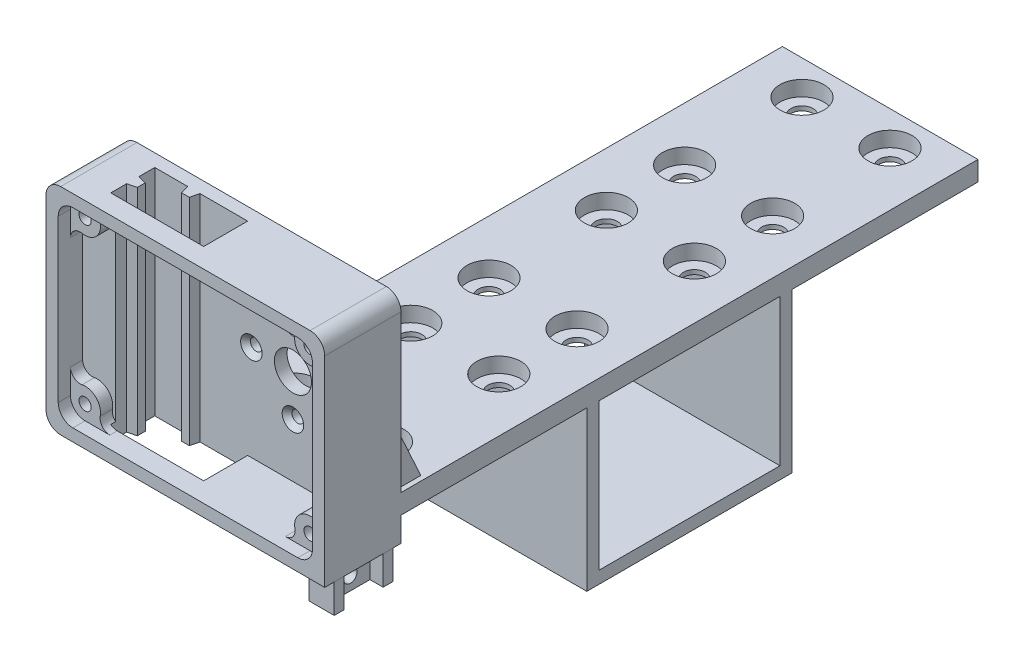
from build123d import *

# Parameters (mm, degrees)
SKETCH1_W                                           = 37
SKETCH1_H                                           = 30
BOSS_EXTRUDE1_DEPTH                                 = 40
CBORE_FOR_M4_PAN_HEAD_MACHINE_SCREW1_D              = 4.5
CBORE_FOR_M4_PAN_HEAD_MACHINE_SCREW1_DEPTH          = 4
CBORE_FOR_M4_PAN_HEAD_MACHINE_SCREW1_CBORE_D        = 9
CBORE_FOR_M4_PAN_HEAD_MACHINE_SCREW1_CBORE_DEPTH    = 3.1
SKETCH5_W                                           = 8
SKETCH5_H                                           = 5.35
SKETCH5_R                                           = 1.35
BOSS_EXTRUDE2_DEPTH                                 = 3
SKETCH6_W                                           = 8
SKETCH6_H                                           = 5.35
SKETCH6_R                                           = 1.35
BOSS_EXTRUDE3_DEPTH                                 = 6
BOSS_EXTRUDE4_REACH                                 = 130.294
SKETCH7_W                                           = 0.8
SKETCH7_H                                           = 2.4
BOSS_EXTRUDE6_DEPTH                                 = 35
BOSS_EXTRUDE6_DEPTH_BACK                            = 9
SKETCH9_W                                           = 57
SKETCH9_H                                           = 2.6
SKETCH8_W                                           = 0.8
SKETCH8_H                                           = 2.4
BOSS_EXTRUDE5_DEPTH                                 = 2
RIB2_REACH                                          = 132.554
SKETCH11_WALL_W                                     = 275.108578948
SKETCH11_WALL_H                                     = 2
RIB3_REACH                                          = 138.749
SKETCH12_WALL_W                                     = 287.498976232
SKETCH12_WALL_H                                     = 2
CUT_EXTRUDE1_REACH                                  = 139.566
SKETCH13_R                                          = 3.8
SKETCH14_W                                          = 57
SKETCH14_H                                          = 44
BOSS_EXTRUDE7_DEPTH                                 = 13
CUT_EXTRUDE2_DEPTH                                  = 13
FILLET3_R                                           = 3
BOSS_EXTRUDE8_DEPTH                                 = 8
CUT_EXTRUDE3_REACH                                  = 153.917
CSK_FOR_M2_COUNTERSUNK_FLAT_HEAD_SCREW1_D           = 2.4
CSK_FOR_M2_COUNTERSUNK_FLAT_HEAD_SCREW1_CSINK_D     = 4.4
CSK_FOR_M2_COUNTERSUNK_FLAT_HEAD_SCREW1_CSINK_ANGLE = 90
BOSS_EXTRUDE9_DEPTH                                 = 10.5
FILLET4_R                                           = 2
MIRROR2_COPY_1_DEPTH                                = 10.5
FILLET5_R                                           = 2
M3_TAPPED_HOLE1_D                                   = 2.5
M3_TAPPED_HOLE1_DEPTH                               = 10
M3_TAPPED_HOLE1_TIP                                 = 0.751075774
BOSS_EXTRUDE10_DEPTH                                = 6
CUT_EXTRUDE5_REACH                                  = 137.472
SKETCH30_R                                          = 1.35
SKETCH31_R                                          = 1.3
CUT_EXTRUDE6_DEPTH                                  = 7
FILLET6_R                                           = 2
SKETCH37_R                                          = 0.9
BOSS_EXTRUDE12_DEPTH                                = 6
BOSS_EXTRUDE12_DRAFT                                = 1
BOSS_EXTRUDE12_PROFILE_2_DEPTH                      = 6
BOSS_EXTRUDE12_PROFILE_2_DRAFT                      = 1


with BuildPart() as part:
    # Sketch1 → Boss-Extrude1 (new body)
    with BuildSketch(Plane(origin=(0, 0, 0), x_dir=(0, 0, -1), z_dir=(1, 0, 0))):
        Polygon((0, 0), (118, 0), (118, -4), (80, -4), (80, -36.5), (38, -36.5), (38, -4), (0, -4), align=None)
        with Locations((59, -19)):
            Rectangle(SKETCH1_W, SKETCH1_H, mode=Mode.SUBTRACT)
    extrude(amount=-BOSS_EXTRUDE1_DEPTH)

    # CBORE for M4 Pan Head Machine Screw1
    with Locations(Plane(origin=(-11, 0, -111), x_dir=(0, 0, 1), z_dir=(0, 1, 0))):
        with Locations((0, 0), (0, -18), (24, 0), (24, -18), (40, 0), (64, 0), (64, -18), (40, -18), (80, 0), (80, -18), (104, -18), (104, 0)):
            CounterBoreHole(CBORE_FOR_M4_PAN_HEAD_MACHINE_SCREW1_D / 2, CBORE_FOR_M4_PAN_HEAD_MACHINE_SCREW1_CBORE_D / 2, CBORE_FOR_M4_PAN_HEAD_MACHINE_SCREW1_CBORE_DEPTH, depth=CBORE_FOR_M4_PAN_HEAD_MACHINE_SCREW1_DEPTH)

    # Sketch5 → Boss-Extrude2 (add)
    with BuildSketch(Plane(origin=(-39, 0, 0), x_dir=(0, 0, -1), z_dir=(1, 0, 0))):
        with Locations((59, -39.175)):
            Rectangle(SKETCH5_W, SKETCH5_H)
        with Locations((59, -39.5)):
            Circle(SKETCH5_R, mode=Mode.SUBTRACT)
    extrude(amount=BOSS_EXTRUDE2_DEPTH)

    # Sketch6 → Boss-Extrude3 (add)
    with BuildSketch(Plane(origin=(-28, 0, 0), x_dir=(0, 0, -1), z_dir=(1, 0, 0))):
        with Locations((59, -39.175)):
            Rectangle(SKETCH6_W, SKETCH6_H)
        with Locations((59, -39.5)):
            Circle(SKETCH6_R, mode=Mode.SUBTRACT)
    extrude(amount=BOSS_EXTRUDE3_DEPTH)

    # Sketch7 → Boss-Extrude4 (add, up to next)
    with BuildSketch(Plane.ZY.offset(28), mode=Mode.PRIVATE) as boss_extrude4_sk1:
        with Locations((-62.6, -39.7)):
            Rectangle(SKETCH7_W, SKETCH7_H)
    boss_extrude4_tool1 = extrude(boss_extrude4_sk1.sketch, amount=BOSS_EXTRUDE4_REACH, mode=Mode.PRIVATE) - part.part
    # Sketch7 → Boss-Extrude4 (add, up to next)
    with BuildSketch(Plane.ZY.offset(28), mode=Mode.PRIVATE) as boss_extrude4_sk2:
        with Locations((-55.4, -39.7)):
            Rectangle(SKETCH7_W, SKETCH7_H)
    boss_extrude4_tool2 = extrude(boss_extrude4_sk2.sketch, amount=BOSS_EXTRUDE4_REACH, mode=Mode.PRIVATE) - part.part
    add(boss_extrude4_tool1.solids().sort_by_distance((-28, -39.7, -62.6))[0])
    add(boss_extrude4_tool2.solids().sort_by_distance((-28, -39.7, -55.4))[0])

    # Sketch9 → Boss-Extrude6 (add, two sides: drawn at the far end of the back side and taken through both)
    with BuildSketch(Plane(origin=(0, 0, 0), x_dir=(1, 0, 0), z_dir=(0, 1, 0)).offset(-BOSS_EXTRUDE6_DEPTH_BACK)):
        with Locations((-28.5, -1.3)):
            Rectangle(SKETCH9_W, SKETCH9_H)
    extrude(amount=BOSS_EXTRUDE6_DEPTH + BOSS_EXTRUDE6_DEPTH_BACK)

    # Sketch8 → Boss-Extrude5 (add)
    with BuildSketch(Plane(origin=(-36, 0, 0), x_dir=(0, 0, -1), z_dir=(1, 0, 0))):
        with Locations((62.6, -39.7)):
            Rectangle(SKETCH8_W, SKETCH8_H)
        with Locations((55.4, -39.7)):
            Rectangle(SKETCH8_W, SKETCH8_H)
    extrude(amount=BOSS_EXTRUDE5_DEPTH)

    # Sketch11 wall → Rib2 (add, up to next)
    with BuildSketch(Plane(origin=(-37, 5.500392788, -2.536212913), x_dir=(0, -0.909059342892, -0.416666666655), z_dir=(0, -0.416666666655, 0.909059342892)), mode=Mode.PRIVATE) as rib2_sk1:
        Rectangle(SKETCH11_WALL_W, SKETCH11_WALL_H)
    rib2_tool1 = extrude(rib2_sk1.sketch, amount=RIB2_REACH, mode=Mode.PRIVATE) - part.part
    add(rib2_tool1.solids().sort_by_distance((-37, 5.500392788, -2.536212913))[0])

    # Sketch12 wall → Rib3 (add, up to next)
    with BuildSketch(Plane(origin=(-2, 5.500392788, -2.536212913), x_dir=(0, -0.909059342892, -0.416666666655), z_dir=(0, 0.416666666655, -0.909059342892)), mode=Mode.PRIVATE) as rib3_sk1:
        Rectangle(SKETCH12_WALL_W, SKETCH12_WALL_H)
    rib3_tool1 = extrude(rib3_sk1.sketch, amount=-RIB3_REACH, mode=Mode.PRIVATE) - part.part
    add(rib3_tool1.solids().sort_by_distance((-2, 5.500392788, -2.536212913))[0])

    # Sketch13 → Cut-Extrude1 (cut, up to next)
    with BuildSketch(Plane(origin=(0, 0, 0), x_dir=(-1, 0, 0), z_dir=(0, 0, -1)), mode=Mode.PRIVATE) as cut_extrude1_sk1:
        with Locations((19.5, 13)):
            Circle(SKETCH13_R)
    cut_extrude1_tool1 = extrude(cut_extrude1_sk1.sketch, amount=-CUT_EXTRUDE1_REACH, mode=Mode.PRIVATE) & part.part
    add(cut_extrude1_tool1.solids().sort_by_distance((-19.5, 13, 0))[0], mode=Mode.SUBTRACT)

    # Sketch14 → Boss-Extrude7 (add)
    with BuildSketch(Plane.XY.offset(2.6)):
        with Locations((-28.5, 13)):
            Rectangle(SKETCH14_W, SKETCH14_H)
    extrude(amount=BOSS_EXTRUDE7_DEPTH)

    # 3DSketch3 → Cut-Extrude2 (cut)
    with BuildSketch(Plane(origin=(-2.5, -6.5, 15.6), x_dir=(-0.799999999999999, 0.6000000000000013, 0), z_dir=(0, 0, 1))):
        Polygon((0, 0), (23.4, -31.2), (65, 0), (41.6, 31.2), align=None)
    extrude(amount=-CUT_EXTRUDE2_DEPTH, mode=Mode.SUBTRACT)

    # Fillet3
    fillet3_edges = [part.edges().sort_by_distance(p)[0] for p in [
        (-57, -9, 7.8),
        (-2.5, -6.5, 9.1),
        (0, 35, 7.8),
        (-2.5, 32.5, 9.1),
        (-54.5, -6.5, 9.1),
        (-54.5, 32.5, 9.1),
        (-57, 35, 7.8),
    ]]
    fillet(fillet3_edges, radius=FILLET3_R)

    # 3DSketch4 → Boss-Extrude8 (add)
    with BuildSketch(Plane(origin=(-54.5, 29.5, 2.6), x_dir=(0.4061384660534426, -0.9138115486202595, 0), z_dir=(0, 0, 1))):
        with BuildLine():
            Line((0, 0), (30.155781104, -13.40256938))
            ThreePointArc((30.155781104, -13.40256938), (32.451133741, -13.461171553), (34.115631148, -11.879550132))
            Line((34.115631148, -11.879550132), (39.395431207, 0))
            Line((39.395431207, 0), (3.756780811, 15.839400176))
            Line((3.756780811, 15.839400176), (-1.523019248, 3.959850044))
            ThreePointArc((-1.523019248, 3.959850044), (-1.58162142, 1.664497408), (0, 0))
        make_face()
    extrude(amount=BOSS_EXTRUDE8_DEPTH)

    # Sketch16 → Cut-Extrude3 (cut, up to next)
    with BuildSketch(Plane(origin=(0, 35, 0), x_dir=(1, 0, 0), z_dir=(0, 1, 0)), mode=Mode.PRIVATE) as cut_extrude3_sk1:
        Polygon((-41.257482137, -2.6), (-47.757482137, -2.6), (-47.757482137, -5.85), (-46.007482137, -6.2875), (-46.007482137, -7.9125), (-47.757482137, -8.35), (-47.757482137, -11.6), (-28.757482137, -11.6), (-28.757482137, -2.6), (-38.507482137, -2.6), (-38.944982137, -4.35), (-40.569982137, -4.35), (-41.007482137, -2.6), align=None)
    cut_extrude3_tool1 = extrude(cut_extrude3_sk1.sketch, amount=-CUT_EXTRUDE3_REACH, mode=Mode.PRIVATE) & part.part
    add(cut_extrude3_tool1.solids().sort_by_distance((-38.032986, 35, 7.18125))[0], mode=Mode.SUBTRACT)

    # CSK for M2 Countersunk Flat Head Screw1 (through all)
    with Locations(Plane.XY.offset(2.6)):
        with Locations((-19.5, 21.5), (-28, 13), (-19.5, 4.5), (-11, 13)):
            CounterSinkHole(CSK_FOR_M2_COUNTERSUNK_FLAT_HEAD_SCREW1_D / 2, CSK_FOR_M2_COUNTERSUNK_FLAT_HEAD_SCREW1_CSINK_D / 2, counter_sink_angle=CSK_FOR_M2_COUNTERSUNK_FLAT_HEAD_SCREW1_CSINK_ANGLE)

    # Sketch20 → Boss-Extrude9 (add)
    with BuildSketch(Plane.XY.offset(2.6)):
        with BuildLine():
            Line((-6.477733719, 32.5), (-5.5, 32.5))
            ThreePointArc((-5.5, 32.5), (-3.378679656, 31.621320344), (-2.5, 29.5))
            Line((-2.5, 29.5), (-2.5, 28.522266281))
            ThreePointArc((-2.5, 28.522266281), (-7.731139084, 27.268860916), (-6.477733719, 32.5))
        make_face()
    boss_extrude9 = extrude(amount=BOSS_EXTRUDE9_DEPTH)

    # Fillet4
    fillet4_edges = [part.edges().sort_by_distance(p)[0] for p in [
        (-2.5, 28.522266281, 7.85),
        (-6.477733719, 32.5, 7.85),
    ]]
    fillet(fillet4_edges, radius=FILLET4_R)

    # Mirror1: Boss-Extrude9 across plane
    add(boss_extrude9.mirror(Plane(origin=(-28.5, 0, 0), x_dir=(0, 0, 1), z_dir=(1, 0, 0))))

    # Mirror2: Boss-Extrude9 across plane
    add(boss_extrude9.mirror(Plane(origin=(0, 13, 0), x_dir=(0, 0, 1), z_dir=(0, -1, 0))))

    # Mirror2 copy 1 sketch → Mirror2 copy 1 (add)
    with BuildSketch(Plane(origin=(-57, 26, 2.6), x_dir=(-1, 0, 0), z_dir=(0, 0, 1))):
        with BuildLine():
            Line((-6.477733719, 32.5), (-5.5, 32.5))
            ThreePointArc((-5.5, 32.5), (-3.378679656, 31.621320344), (-2.5, 29.5))
            Line((-2.5, 29.5), (-2.5, 28.522266281))
            ThreePointArc((-2.5, 28.522266281), (-7.731139084, 27.268860916), (-6.477733719, 32.5))
        make_face()
    extrude(amount=MIRROR2_COPY_1_DEPTH)

    # Fillet5
    fillet5_edges = [part.edges().sort_by_distance(p)[0] for p in [
        (-50.522266281, 32.5, 11.85),
        (-6.477733719, -6.5, 7.85),
        (-2.5, -2.522266281, 7.85),
        (-50.522266281, -6.5, 11.85),
        (-54.5, -2.522266281, 11.85),
        (-54.5, 28.522266281, 11.85),
    ]]
    fillet(fillet5_edges, radius=FILLET5_R)

    # M3 Tapped Hole1
    with Locations(Plane.XY.offset(13.1)):
        with Locations((-5.5, -3.5), (-51.5, 29.5), (-51.5, -3.5), (-5.5, 29.5)):
            Hole(M3_TAPPED_HOLE1_D / 2, depth=M3_TAPPED_HOLE1_DEPTH)
            with Locations((0, 0, -(M3_TAPPED_HOLE1_DEPTH + M3_TAPPED_HOLE1_TIP / 2))):  # 118° drill point
                Cone(0, M3_TAPPED_HOLE1_D / 2, M3_TAPPED_HOLE1_TIP, mode=Mode.SUBTRACT)

    # Sketch27 → Boss-Extrude10 (add)
    with BuildSketch(Plane.XZ.offset(9)):
        Polygon((-5.257482137, 13.6), (-5.257482137, 1.6), (-0.057482137, 1.6), (-0.057482137, 3.6), (-2.757482137, 3.6), (-2.757482137, 11.6), (-0.057482137, 11.6), (-0.057482137, 13.6), align=None)
    extrude(amount=BOSS_EXTRUDE10_DEPTH)

    # Sketch30 → Cut-Extrude5 (cut, up to next)
    with BuildSketch(Plane.ZY.offset(5.257482137), mode=Mode.PRIVATE) as cut_extrude5_sk1:
        with Locations((7.6, -12.3)):
            Circle(SKETCH30_R)
    cut_extrude5_tool1 = extrude(cut_extrude5_sk1.sketch, amount=-CUT_EXTRUDE5_REACH, mode=Mode.PRIVATE) & part.part
    add(cut_extrude5_tool1.solids().sort_by_distance((-5.257482, -12.3, 7.6))[0], mode=Mode.SUBTRACT)

    # Sketch31 → Cut-Extrude6 (cut)
    with BuildSketch(Plane.ZY.offset(57)):
        with Locations((4.5, 25)):
            Circle(SKETCH31_R)
    extrude(amount=-CUT_EXTRUDE6_DEPTH, mode=Mode.SUBTRACT)

    # Fillet6
    fillet6_edges = [part.edges().sort_by_distance(p)[0] for p in [
        (-5.257482137, -9, 7.6),
    ]]
    fillet(fillet6_edges, radius=FILLET6_R)


with BuildPart() as body_2:
    # Sketch37 → Boss-Extrude12 (with draft: the straight prism first)
    with BuildSketch(Plane(origin=(0, 0, 0), x_dir=(-1, 0, 0), z_dir=(0, 0, -1))):
        with Locations((50.153517035, -3.892144686)):
            Circle(SKETCH37_R)
    extrude(amount=BOSS_EXTRUDE12_DEPTH)
    # Boss-Extrude12: the draft: its side faces are tilted about the plane it starts from
    boss_extrude12_sides = [body_2.faces().sort_by_distance(p)[0] for p in [
        (-49.253517035, -3.892144686, -3),
    ]]
    draft(boss_extrude12_sides, Plane(origin=(0, 0, 0), x_dir=(-1, 0, 0), z_dir=(0, 0, -1)), BOSS_EXTRUDE12_DRAFT)


with BuildPart() as body_3:
    # Sketch37 → Boss-Extrude12 profile 2 (with draft: the straight prism first)
    with BuildSketch(Plane(origin=(0, 0, 0), x_dir=(-1, 0, 0), z_dir=(0, 0, -1))):
        with Locations((43.653517035, -3.892144686)):
            Circle(SKETCH37_R)
    extrude(amount=BOSS_EXTRUDE12_PROFILE_2_DEPTH)
    # Boss-Extrude12 profile 2: the draft: its side faces are tilted about the plane it starts from
    boss_extrude12_profile_2_sides = [body_3.faces().sort_by_distance(p)[0] for p in [
        (-42.753517035, -3.892144686, -3),
    ]]
    draft(boss_extrude12_profile_2_sides, Plane(origin=(0, 0, 0), x_dir=(-1, 0, 0), z_dir=(0, 0, -1)), BOSS_EXTRUDE12_PROFILE_2_DRAFT)


solid = Compound([part.part, body_2.part, body_3.part])
